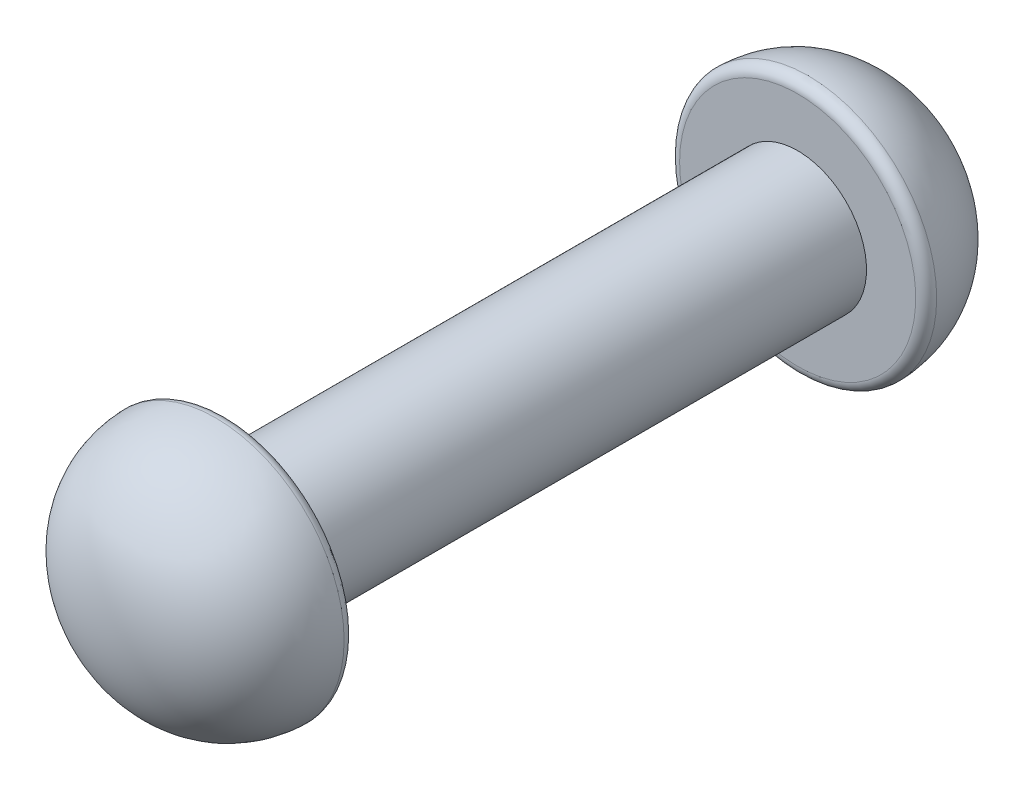
from build123d import *

# Parameters (mm, degrees)
SKETCH1_R           = 1
BOSS_EXTRUDE1_DEPTH = 8.3
FILLET1_R           = 0.15
FILLET2_R           = 0.15


with BuildPart() as part:
    # Sketch1 → Boss-Extrude1 (new body)
    with BuildSketch(Plane.XY):
        with Locations(Location((0, 0, 0), (0, 0, 180))):
            Circle(SKETCH1_R)
    extrude(amount=BOSS_EXTRUDE1_DEPTH)

    # Sketch2 → Revolve1 (revolve)
    with BuildSketch(Plane(origin=(0, 0, 0), x_dir=(1, 0, 0), z_dir=(0, 1, 0))):
        with BuildLine():
            Line((0, 0), (1.86246764, 0))
            add(Edge.make_bspline(
                [(1.86246764, 0), (1.916751975, 0.840718666), (1.329815324, 1.708509957), (0, 1.708509957)],
                knots=[0, 0, 0, 0, 1, 1, 1, 1], degree=3))
            Line((0, 1.708509957), (0, 0))
        make_face()
        with BuildLine():
            Line((0, -8.3), (1.86246764, -8.3))
            add(Edge.make_bspline(
                [(1.86246764, -8.3), (1.916751975, -9.140718666), (1.329815324, -10.008509957), (0, -10.008509957)],
                knots=[0, 0, 0, 0, 1, 1, 1, 1], degree=3))
            Line((0, -10.008509957), (0, -8.3))
        make_face()
    revolve(axis=Axis((0, 0, -4.836287687), (0, 0, 1)))

    # Fillet1
    fillet1_edges = [part.edges().sort_by_distance(p)[0] for p in [
        (-1.86246764, 0, 8.3),
    ]]
    fillet(fillet1_edges, radius=FILLET1_R)

    # Fillet2
    fillet2_edges = [part.edges().sort_by_distance(p)[0] for p in [
        (-1.86246764, 0, 0),
    ]]
    fillet(fillet2_edges, radius=FILLET2_R)


solid = part.part
